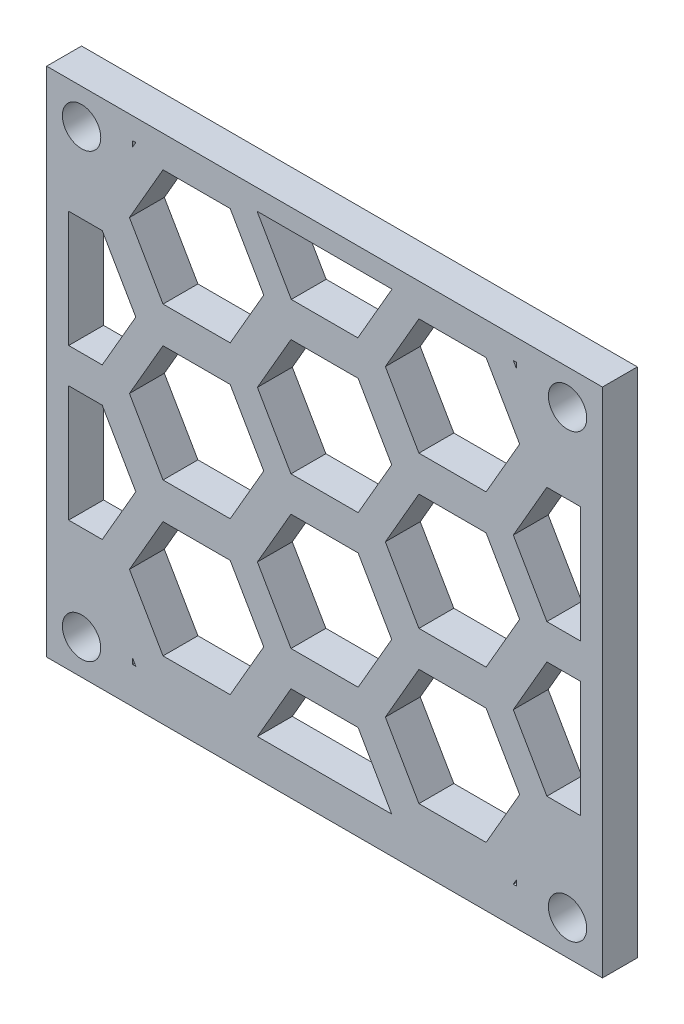
from build123d import *

# Parameters (mm, degrees)
RESSALTO_EXTRUS_O2_DEPTH = 3
RESSALTO_EXTRUS_O3_DEPTH = 3
ESBO_O4_R                = 1.65
CORTE_EXTRUS_O2_DEPTH    = 55.465328173


with BuildPart() as part:
    # Esboço1 → Ressalto-extrusão2 (new body)
    with BuildSketch(Plane.XY):
        Polygon((-23.89, 48.854271798), (-23.89, 4.854271798), (-18.042684332, 4.854271798), (3.957315668, 4.854271798), (18.042684332, 4.854271798), (23.89, 4.854271798), (23.89, 48.854271798), align=None)
        Polygon((19.113248654, 42), (16.226497308, 47), (22, 47), (22, 42), align=None, mode=Mode.SUBTRACT)
        Polygon((-16.226497308, 8), (-22, 8), (-22, 13), (-19.113248654, 13), align=None, mode=Mode.SUBTRACT)
        Polygon((-8.113248654, 19.947441117), (-5.226497308, 14.947441117), (-8.113248654, 9.947441117), (-13.886751346, 9.947441117), (-16.773502692, 14.947441117), (-13.886751346, 19.947441117), align=None, mode=Mode.SUBTRACT)
        Polygon((-19.113248654, 16), (-22, 16), (-22, 26), (-19.113248654, 26), (-16.226497308, 21), align=None, mode=Mode.SUBTRACT)
        Polygon((-2.886751346, 13), (2.886751346, 13), (5.773502692, 8), (-5.773502692, 8), align=None, mode=Mode.SUBTRACT)
        Polygon((22, 8), (16.226497308, 8), (19.113248654, 13), (22, 13), align=None, mode=Mode.SUBTRACT)
        Polygon((13.886751346, 19.947441117), (16.773502692, 14.947441117), (13.886751346, 9.947441117), (8.113248654, 9.947441117), (5.226497308, 14.947441117), (8.113248654, 19.947441117), align=None, mode=Mode.SUBTRACT)
        Polygon((-2.886751346, 26), (2.886751346, 26), (5.773502692, 21), (2.886751346, 16), (-2.886751346, 16), (-5.773502692, 21), align=None, mode=Mode.SUBTRACT)
        Polygon((22, 16), (19.113248654, 16), (16.226497308, 21), (19.113248654, 26), (22, 26), align=None, mode=Mode.SUBTRACT)
        Polygon((-19.113248654, 29), (-22, 29), (-22, 39), (-19.113248654, 39), (-16.226497308, 34), align=None, mode=Mode.SUBTRACT)
        Polygon((-8.113248654, 33.044060566), (-5.226497308, 28.044060566), (-8.113248654, 23.044060566), (-13.886751346, 23.044060566), (-16.773502692, 28.044060566), (-13.886751346, 33.044060566), align=None, mode=Mode.SUBTRACT)
        Polygon((-19.113248654, 42), (-22, 42), (-22, 47), (-16.226497308, 47), align=None, mode=Mode.SUBTRACT)
        Polygon((-8.113248654, 46.140680015), (-5.226497308, 41.140680015), (-8.113248654, 36.140680015), (-13.886751346, 36.140680015), (-16.773502692, 41.140680015), (-13.886751346, 46.140680015), align=None, mode=Mode.SUBTRACT)
        Polygon((-2.886751346, 39), (2.886751346, 39), (5.773502692, 34), (2.886751346, 29), (-2.886751346, 29), (-5.773502692, 34), align=None, mode=Mode.SUBTRACT)
        Polygon((13.886751346, 32.995750841), (16.773502692, 27.995750841), (13.886751346, 22.995750841), (8.113248654, 22.995750841), (5.226497308, 27.995750841), (8.113248654, 32.995750841), align=None, mode=Mode.SUBTRACT)
        Polygon((19.113248654, 39), (22, 39), (22, 29), (19.113248654, 29), (16.226497308, 34), align=None, mode=Mode.SUBTRACT)
        Polygon((-5.801394324, 47.096619449), (5.801394324, 47.096619449), (2.858859713, 42), (-2.858859713, 42), align=None, mode=Mode.SUBTRACT)
        Polygon((13.886751346, 46.044060566), (16.773502692, 41.044060566), (13.886751346, 36.044060566), (8.113248654, 36.044060566), (5.226497308, 41.044060566), (8.113248654, 46.044060566), align=None, mode=Mode.SUBTRACT)
    extrude(amount=RESSALTO_EXTRUS_O2_DEPTH)

    # Esboço2 → Ressalto-extrusão3 (add)
    with BuildSketch(Plane.XY.offset(3)):
        Polygon((22.5, 48.854271798), (-22.5, 48.854271798), (-22.5, 42), (-16.5, 42), (-16.5, 47.096619449), (16.5, 47.096619449), (16.5, 42), (22.5, 42), align=None)
        Polygon((-22.5, 13), (-22.5, 4.854271798), (22.5, 4.854271798), (22.5, 13), (16.5, 13), (16.5, 8), (-16.5, 8), (-16.5, 13), align=None)
    extrude(amount=-RESSALTO_EXTRUS_O3_DEPTH)

    # Esboço4 → Corte-extrusão2 (cut, through all)
    with BuildSketch(Plane.XY.offset(3)):
        with Locations((-20.89, 45.854271798)):
            Circle(ESBO_O4_R)
        with Locations((-20.89, 7.854271798)):
            Circle(ESBO_O4_R)
        with Locations(Location((20.89, 7.854271798, 0), (0, 0, 180))):
            Circle(ESBO_O4_R)
        with Locations(Location((20.89, 45.854271798, 0), (0, 0, 180))):
            Circle(ESBO_O4_R)
    extrude(amount=-CORTE_EXTRUS_O2_DEPTH, mode=Mode.SUBTRACT)


solid = part.part
